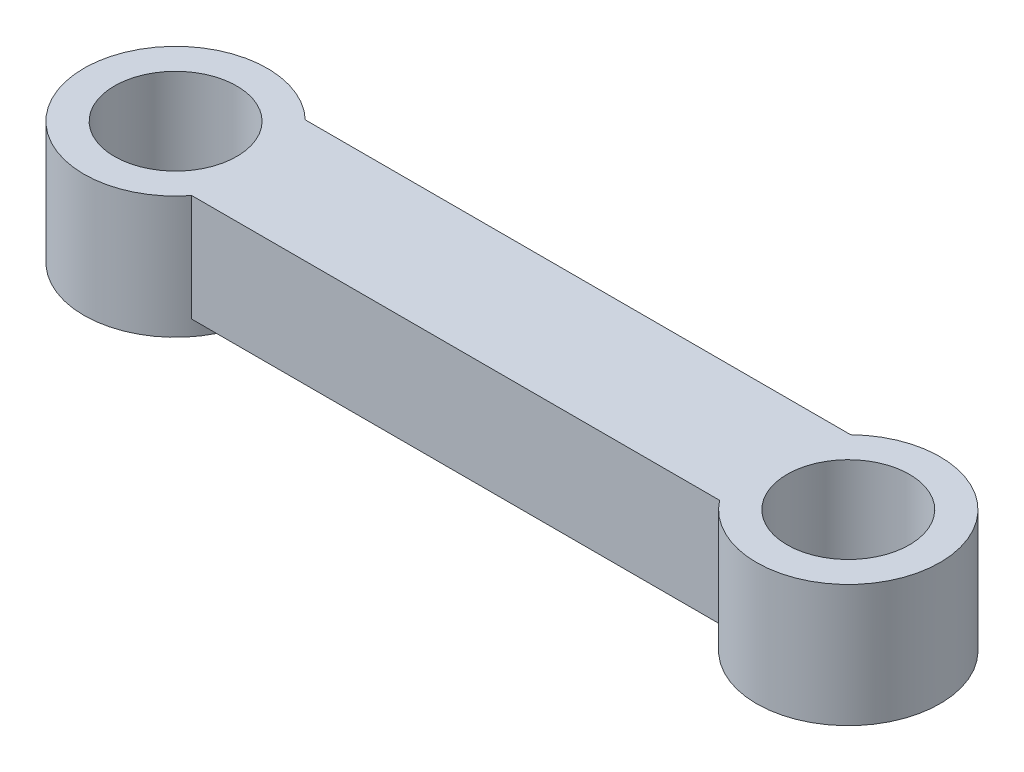
from build123d import *

# Parameters (mm, degrees)
ESQUISSE1_W             = 28
ESQUISSE1_H             = 4
BOSS_EXTRU_1_DEPTH      = 3.5
ESQUISSE2_R             = 3
BOSS_EXTRU_2_DEPTH      = 4
ESQUISSE3_R             = 2
ENL_V_MAT_EXTRU_1_DEPTH = 4
ENL_V_MAT_EXTRU_2_DEPTH = 4
ENL_V_MAT_EXTRU_3_DEPTH = 4


with BuildPart() as part:
    # Esquisse1 → Boss.-Extru.1 (new body)
    with BuildSketch(Plane(origin=(0, 0, 0), x_dir=(1, 0, 0), z_dir=(0, 1, 0))):
        with Locations((14, 2)):
            Rectangle(ESQUISSE1_W, ESQUISSE1_H)
    extrude(amount=BOSS_EXTRU_1_DEPTH)

    # Esquisse2 → Boss.-Extru.2 (add)
    with BuildSketch(Plane(origin=(0, 3.5, 0), x_dir=(1, 0, 0), z_dir=(0, 1, 0))):
        with Locations(Location((3, 1.840675307, 0), (0, 0, 270))):
            Circle(ESQUISSE2_R)
        with Locations(Location((25, 1.840675307, 0), (0, 0, 270))):
            Circle(ESQUISSE2_R)
    extrude(amount=-BOSS_EXTRU_2_DEPTH)

    # Esquisse3 → Enlèv. mat.-Extru.1 (cut)
    with BuildSketch(Plane(origin=(0, 3.5, 0), x_dir=(1, 0, 0), z_dir=(0, 1, 0))):
        with Locations(Location((3, 1.840675307, 0), (0, 0, 270))):
            Circle(ESQUISSE3_R)
        with Locations(Location((25, 1.840675307, 0), (0, 0, 270))):
            Circle(ESQUISSE3_R)
    extrude(amount=-ENL_V_MAT_EXTRU_1_DEPTH, mode=Mode.SUBTRACT)

    # Esquisse4 → Enlèv. mat.-Extru.2 (cut)
    with BuildSketch(Plane(origin=(0, 3.5, 0), x_dir=(1, 0, 0), z_dir=(0, 1, 0))):
        with BuildLine():
            Line((0.917377406, 4), (-0.491965761, 5.461248673))
            Line((-0.491965761, 5.461248673), (-4.245883295, 1.840675307))
            Line((-4.245883295, 1.840675307), (-0.73023333, -1.804454542))
            Line((-0.73023333, -1.804454542), (0.631052045, 0))
            ThreePointArc((0.631052045, 0), (0.007656422, 2.054871271), (0.917377406, 4))
        make_face()
    extrude(amount=-ENL_V_MAT_EXTRU_2_DEPTH, mode=Mode.SUBTRACT)

    # Esquisse5 → Enlèv. mat.-Extru.3 (cut)
    with BuildSketch(Plane(origin=(0, 3.5, 0), x_dir=(1, 0, 0), z_dir=(0, 1, 0))):
        with BuildLine():
            Line((27.082622594, 4), (30.63271591, 7.550093316))
            Line((30.63271591, 7.550093316), (35.597188908, 2.585620319))
            Line((35.597188908, 2.585620319), (29.60753561, -3.40403298))
            Line((29.60753561, -3.40403298), (27.368947955, 0))
            ThreePointArc((27.368947955, 0), (27.992343578, 2.054871271), (27.082622594, 4))
        make_face()
    extrude(amount=-ENL_V_MAT_EXTRU_3_DEPTH, mode=Mode.SUBTRACT)


solid = part.part
